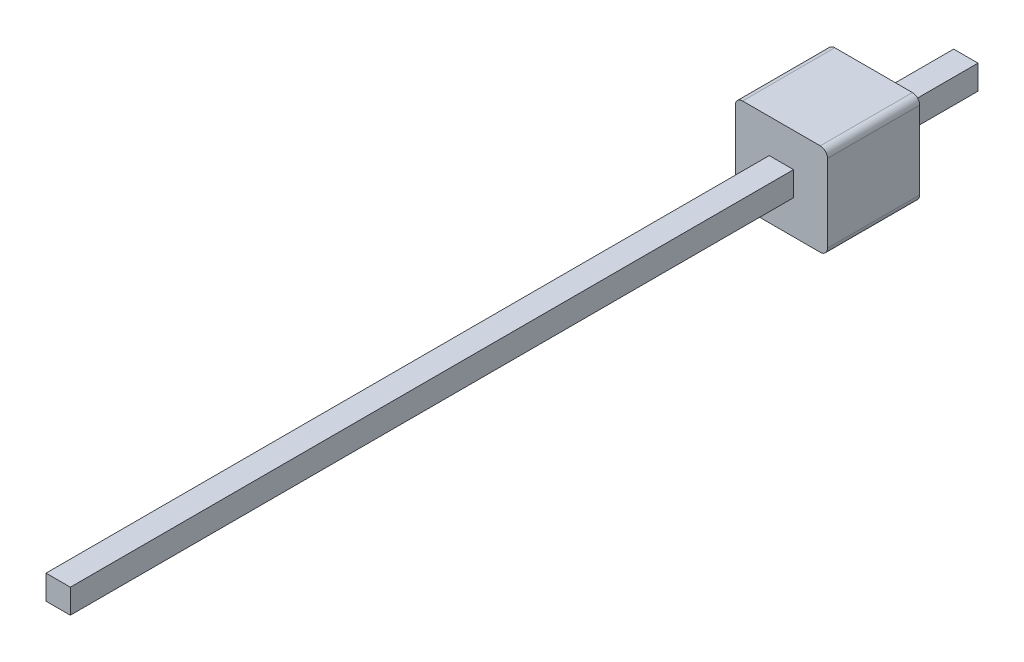
from build123d import *

# Parameters (mm, degrees)
SKETCH_1_W        = 2.54
SKETCH_1_H        = 2.54
EXTRUDE_1_DEPTH   = 2.54
SKETCH_2_W        = 0.67
SKETCH_2_H        = 0.67
EXTRUDE_1_2_DEPTH = 2.54
SKETCH_3_W        = 0.67
SKETCH_3_H        = 0.67
EXTRUDE_2_DEPTH   = 19.92
FILLET_1_R        = 0.2


with BuildPart() as part:
    # 草图1 → Extrude 1 (new body)
    with BuildSketch(Plane.XY):
        Rectangle(SKETCH_1_W, SKETCH_1_H)
    extrude(amount=EXTRUDE_1_DEPTH)

    # 草图2 → Extrude 1 2 (add)
    with BuildSketch(Plane(origin=(0, 0, 0), x_dir=(-1, 0, 0), z_dir=(0, 0, -1))):
        Rectangle(SKETCH_2_W, SKETCH_2_H)
    extrude(amount=EXTRUDE_1_2_DEPTH)

    # 草图3 → 凸台-拉伸2 (add)
    with BuildSketch(Plane.XY.offset(2.54)):
        Rectangle(SKETCH_3_W, SKETCH_3_H)
    extrude(amount=EXTRUDE_2_DEPTH)

    # 圆角1
    fillet_1_edges = [part.edges().sort_by_distance(p)[0] for p in [
        (-1.27, 1.27, 1.27),
        (1.27, 1.27, 1.27),
        (1.27, -1.27, 1.27),
        (-1.27, -1.27, 1.27),
    ]]
    fillet(fillet_1_edges, radius=FILLET_1_R)


solid = part.part
